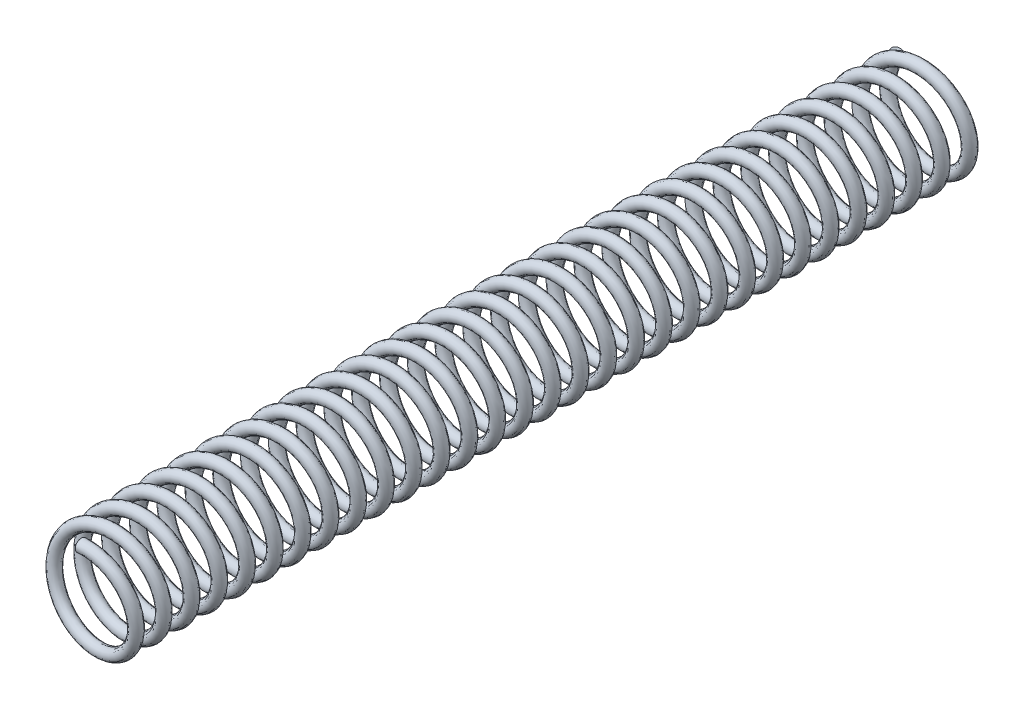
from build123d import *

# Parameters (mm, degrees)
SWEEP2_PITCH       = 2.059459459
SWEEP2_HEIGHT      = 63.5
SWEEP2_RADIUS      = 3.9751
SWEEP2_START_ANGLE = 90
SKETCH7_R          = 0.4445


with BuildPart() as part:
    # Sweep2: sweep along a helix
    with BuildLine() as sweep2_path:
        add(Helix(SWEEP2_PITCH, SWEEP2_HEIGHT, SWEEP2_RADIUS, center=(0, 0, 0), direction=(0, 0, -1), mode=Mode.PRIVATE).rotate(Axis((0, 0, 0), (0, 0, -1)), SWEEP2_START_ANGLE))
    # Sketch7 → Sweep2 (sweep)
    with BuildSketch(Plane(origin=(0, 0, 0), x_dir=(1, 0, 0), z_dir=(0, 1, 0))):
        with Locations((3.5306, 0)):
            Circle(SKETCH7_R)
    sweep(path=sweep2_path.line, is_frenet=True)


solid = part.part
